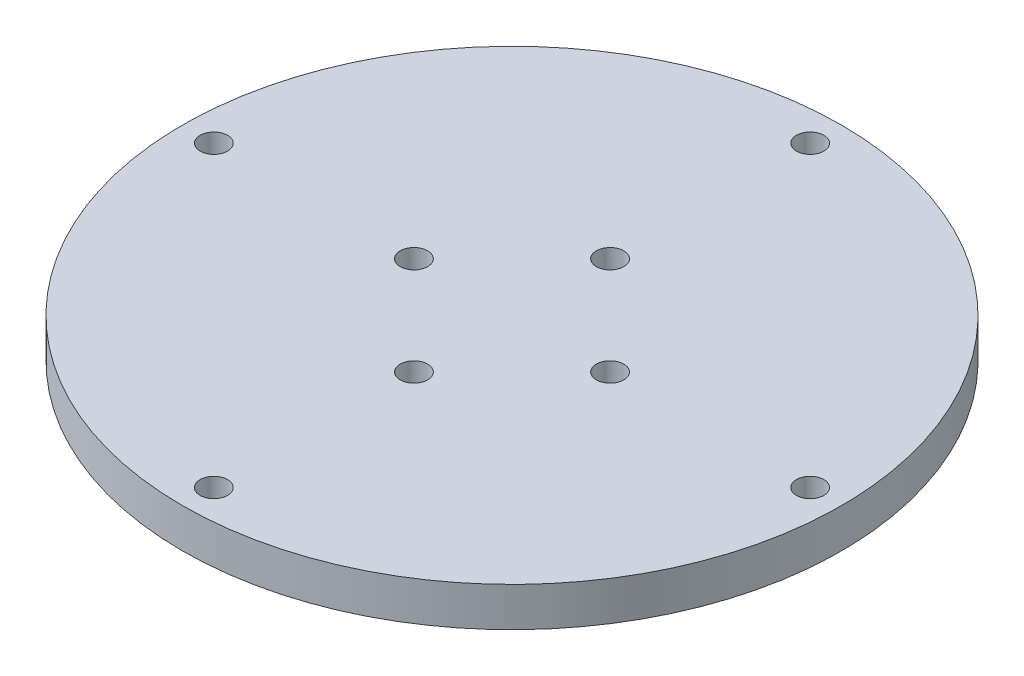
from build123d import *

# Parameters (mm, degrees)
SKETCH1_R            = 84
BOSS_EXTRUDE1_DEPTH  = 10
M6_CLEARANCE_HOLE1_D = 7


with BuildPart() as part:
    # Sketch1 → Boss-Extrude1 (new body)
    with BuildSketch(Plane(origin=(0, 0, 0), x_dir=(1, 0, 0), z_dir=(0, 1, 0))):
        with Locations(Location((0, 0, 0), (0, 0, 270))):
            Circle(SKETCH1_R)
    extrude(amount=BOSS_EXTRUDE1_DEPTH)

    # M6 Clearance Hole1 (through all)
    with Locations(Plane(origin=(0, 10, -76), x_dir=(0, 0, 1), z_dir=(0, 1, 0))):
        with Locations((0, 0), (76, -76), (76, 76), (76, 25), (51, 0), (76, -25), (101, 0), (152, 0)):
            Hole(M6_CLEARANCE_HOLE1_D / 2)


solid = part.part
